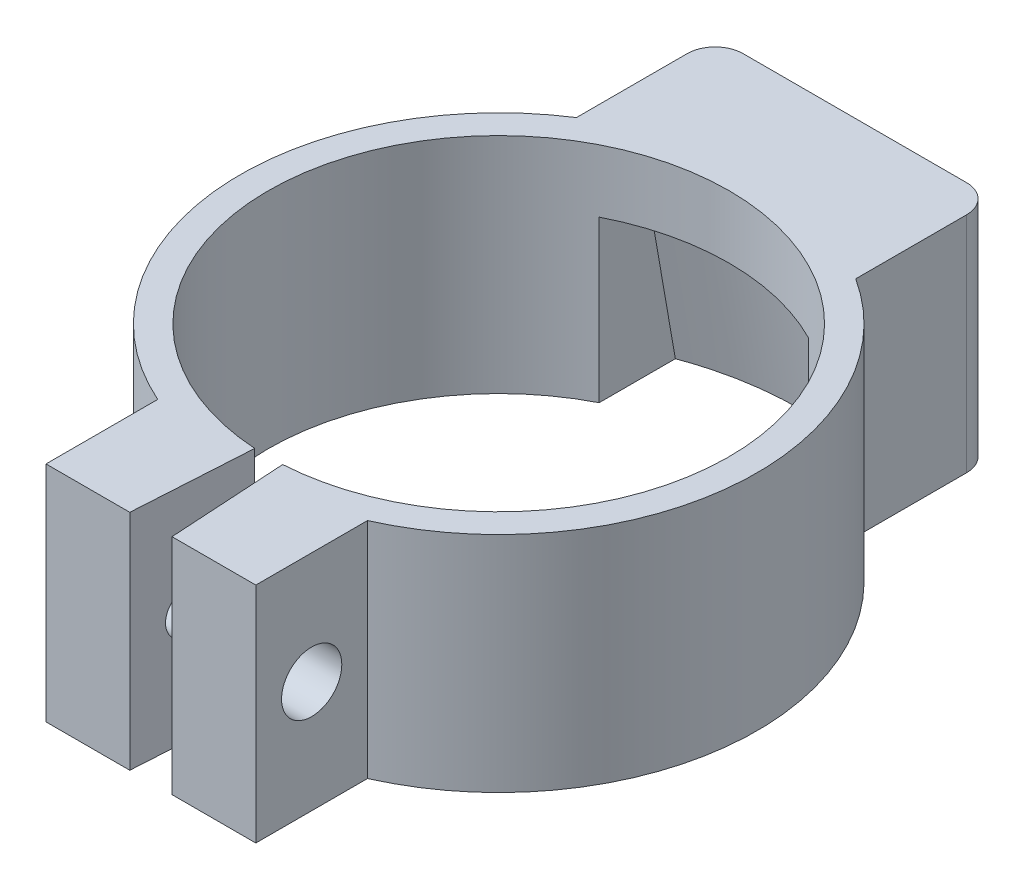
from build123d import *

# Parameters (mm, degrees)
BOSS_EXTRUDE1_DEPTH = 16
CUT_EXTRUDE1_REACH  = 41.786
SKETCH4_R           = 1.5875
CUT_EXTRUDE2_REACH  = 41.786
SKETCH5_R           = 2.159
FILLET1_R           = 2


with BuildPart() as part:
    # Sketch1 → Boss-Extrude1 (new body)
    with BuildSketch(Plane(origin=(0, 0, 0), x_dir=(1, 0, 0), z_dir=(0, 1, 0))):
        with BuildLine():
            Line((1, -16.469669092), (1.512240508, -24.90610075))
            Line((1.512240508, -24.90610075), (7.512240508, -24.90610075))
            Line((7.512240508, -24.90610075), (7.512240508, -16.90610075))
            ThreePointArc((7.512240508, -16.90610075), (18.445940235, -1.413254699), (10, 15.564382416))
            Line((10, 15.564382416), (10, 25.5))
            Line((10, 25.5), (-10, 25.5))
            Line((-10, 25.5), (-10, 15.564382416))
            ThreePointArc((-10, 15.564382416), (-18.445940235, -1.413254699), (-7.512240508, -16.90610075))
            Line((-7.512240508, -16.90610075), (-7.512240508, -24.90610075))
            Line((-7.512240508, -24.90610075), (-1.512240508, -24.90610075))
            Line((-1.512240508, -24.90610075), (-1, -16.469669092))
            ThreePointArc((-1, -16.469669092), (0, 16.5), (1, -16.469669092))
        make_face()
    extrude(amount=BOSS_EXTRUDE1_DEPTH)

    # Cut-Sweep1: sweep along a path in Sketch2
    with BuildLine(Plane(origin=(0, 0, 0), x_dir=(0, 0, -1), z_dir=(1, 0, 0))) as cut_sweep1_path:
        Line((19.5, 11.510254581), (21.5, 0))
    # Sketch3 → Cut-Sweep1 (sweep, cut)
    with BuildSketch(Plane(origin=(0, 0, 0), x_dir=(1, 0, 0), z_dir=(0, 1, 0))):
        with BuildLine():
            Line((-7.5, 20.14944168), (-7.5, 12.323332295))
            Line((-7.5, 12.323332295), (7.5, 12.323332295))
            Line((7.5, 12.323332295), (7.5, 20.14944168))
            ThreePointArc((7.5, 20.14944168), (0, 21.5), (-7.5, 20.14944168))
        make_face()
    sweep(path=cut_sweep1_path.line, mode=Mode.SUBTRACT)

    # Cut-Extrude1: up to this plane
    cut_extrude1_end = Plane(origin=(-1, 16, 16.469669092), z_dir=(-0.9981617631515517, 0, -0.06060606060606122))
    # Sketch4 → Cut-Extrude1 (cut, up to the surface)
    with BuildSketch(Plane.ZY.offset(7.512240508), mode=Mode.PRIVATE) as cut_extrude1_sk1:
        with Locations((20.90610075, 8)):
            Circle(SKETCH4_R)
    cut_extrude1_tool1 = split(extrude(cut_extrude1_sk1.sketch, amount=-CUT_EXTRUDE1_REACH, mode=Mode.PRIVATE), bisect_by=cut_extrude1_end, keep=Keep.BOTH, mode=Mode.PRIVATE)
    add(cut_extrude1_tool1.solids().sort_by_distance((-7.512241, 8, 20.906101))[0], mode=Mode.SUBTRACT)

    # Cut-Extrude2: up to this plane
    cut_extrude2_end = Plane(origin=(1, 16, 16.469669092), z_dir=(0.9981617631515518, 0, -0.06060606060606071))
    # Sketch5 → Cut-Extrude2 (cut, up to the surface)
    with BuildSketch(Plane(origin=(7.512240508, 0, 0), x_dir=(0, 0, -1), z_dir=(1, 0, 0)), mode=Mode.PRIVATE) as cut_extrude2_sk1:
        with Locations((-20.90610075, 8)):
            Circle(SKETCH5_R)
    cut_extrude2_tool1 = split(extrude(cut_extrude2_sk1.sketch, amount=-CUT_EXTRUDE2_REACH, mode=Mode.PRIVATE), bisect_by=cut_extrude2_end, keep=Keep.BOTH, mode=Mode.PRIVATE)
    add(cut_extrude2_tool1.solids().sort_by_distance((7.512241, 8, 20.906101))[0], mode=Mode.SUBTRACT)

    # Fillet1
    fillet1_edges = [part.edges().sort_by_distance(p)[0] for p in [
        (-10, 8, -25.5),
        (10, 8, -25.5),
    ]]
    fillet(fillet1_edges, radius=FILLET1_R)


solid = part.part
